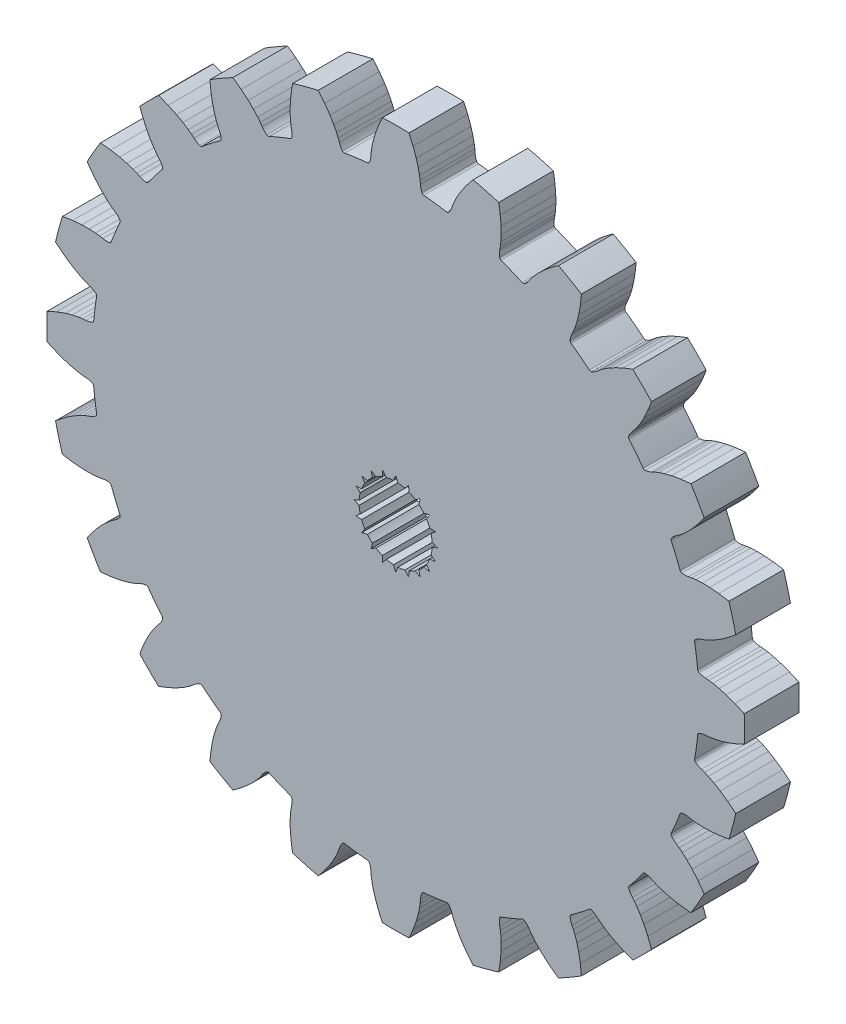
from build123d import *

# Parameters (mm, degrees)
BOSS_EXTRUDE1_DEPTH = 6.35
CUT_EXTRUDE1_DEPTH  = 58.632651032


with BuildPart() as part:
    # Model → Boss-Extrude1 (new body)
    with BuildSketch(Plane.XY):
        with BuildLine():
            ThreePointArc((34.918122358, -4.597058019), (34.999024317, -3.934019352), (35.067337394, -3.269565647))
            ThreePointArc((35.067337394, -3.269565647), (35.117289307, -3.136889034), (35.227836474, -3.048133181))
            ThreePointArc((35.227836474, -3.048133181), (35.597586296, -2.925959175), (35.983262257, -2.872149586))
            ThreePointArc((35.983262257, -2.872149586), (36.173696873, -2.859616768), (36.363582299, -2.840487209))
            ThreePointArc((36.363582299, -2.840487209), (36.599053851, -2.809299698), (36.833565008, -2.771563378))
            ThreePointArc((36.833565008, -2.771563378), (37.195949989, -2.701153106), (37.555494844, -2.617439436))
            ThreePointArc((37.555494844, -2.617439436), (37.966482977, -2.506715419), (38.373723351, -2.382915857))
            ThreePointArc((38.373723351, -2.382915857), (38.883469202, -2.208794801), (39.386594794, -2.016379586))
            ThreePointArc((39.386594794, -2.016379586), (39.934832511, -1.784794144), (40.475208291, -1.535414057))
            ThreePointArc((40.475208291, -1.535414057), (40.504320541, 0), (40.475208291, 1.535414057))
            ThreePointArc((40.475208291, 1.535414057), (39.934832515, 1.784794142), (39.386594803, 2.016379583))
            ThreePointArc((39.386594803, 2.016379583), (38.883469215, 2.208794797), (38.373723367, 2.382915852))
            ThreePointArc((38.373723367, 2.382915852), (37.966482996, 2.506715414), (37.555494865, 2.617439431))
            ThreePointArc((37.555494865, 2.617439431), (37.195950011, 2.701153102), (36.83356503, 2.771563374))
            ThreePointArc((36.83356503, 2.771563374), (36.599053872, 2.809299694), (36.363582319, 2.840487206))
            ThreePointArc((36.363582319, 2.840487206), (36.173696892, 2.859616766), (35.983262273, 2.872149585))
            ThreePointArc((35.983262273, 2.872149585), (35.597586321, 2.925959167), (35.227836504, 3.048133159))
            ThreePointArc((35.227836504, 3.048133159), (35.117289331, 3.136889003), (35.067337397, 3.269565608))
            ThreePointArc((35.067337397, 3.269565608), (34.91812236, 4.597058), (34.718672707, 5.917936879))
            ThreePointArc((34.718672707, 5.917936879), (34.732583315, 6.059021153), (34.816391973, 6.173364435))
            ThreePointArc((34.816391973, 6.173364435), (35.141921916, 6.38707376), (35.500529341, 6.538870115))
            ThreePointArc((35.500529341, 6.538870115), (35.681231323, 6.600263994), (35.859695466, 6.667887693))
            ThreePointArc((35.859695466, 6.667887693), (36.079071597, 6.758957038), (36.295825102, 6.856103477))
            ThreePointArc((36.295825102, 6.856103477), (36.627638596, 7.017906712), (36.953265565, 7.191824964))
            ThreePointArc((36.953265565, 7.191824964), (37.321592132, 7.405147707), (37.682914442, 7.630130466))
            ThreePointArc((37.682914442, 7.630130466), (38.13022528, 7.930250426), (38.56640656, 8.246327736))
            ThreePointArc((38.56640656, 8.246327736), (39.036024807, 8.611916458), (39.493443412, 8.992658669))
            ThreePointArc((39.493443412, 8.992658669), (39.124169287, 10.483289565), (38.698654612, 11.958850852))
            ThreePointArc((38.698654612, 11.958850852), (38.112147379, 12.059873974), (37.522651691, 12.141673971))
            ThreePointArc((37.522651691, 12.141673971), (36.986868971, 12.197314312), (36.449426446, 12.233570402))
            ThreePointArc((36.449426446, 12.233570402), (36.024020769, 12.247750032), (35.598379235, 12.248329665))
            ThreePointArc((35.598379235, 12.248329665), (35.229418882, 12.236133805), (34.861158351, 12.210352771))
            ThreePointArc((34.861158351, 12.210352771), (34.624871089, 12.186107303), (34.389351112, 12.155287604))
            ThreePointArc((34.389351112, 12.155287604), (34.20098478, 12.124619375), (34.013795331, 12.087437043))
            ThreePointArc((34.013795331, 12.087437043), (33.627334023, 12.039592826), (33.23856217, 12.061905546))
            ThreePointArc((33.23856217, 12.061905546), (33.108810098, 12.119025393), (33.026221003, 12.234252641))
            ThreePointArc((33.026221003, 12.234252641), (32.538510031, 13.477892133), (32.00398785, 14.702141787))
            ThreePointArc((32.00398785, 14.702141787), (31.980909169, 14.842019062), (32.032267897, 14.974157468))
            ThreePointArc((32.032267897, 14.974157468), (32.291393633, 15.264838172), (32.598494018, 15.504276623))
            ThreePointArc((32.598494018, 15.504276623), (32.757148825, 15.610347671), (32.912029648, 15.721857067))
            ThreePointArc((32.912029648, 15.721857067), (33.100360238, 15.86660202), (33.284584698, 16.01653821))
            ThreePointArc((33.284584698, 16.01653821), (33.563214162, 16.258707785), (33.832732305, 16.510978377))
            ThreePointArc((33.832732305, 16.510978377), (34.13329646, 16.812362255), (34.424077188, 17.123196008))
            ThreePointArc((34.424077188, 17.123196008), (34.778469517, 17.528862191), (35.117981453, 17.947061451))
            ThreePointArc((35.117981453, 17.947061451), (35.476976522, 18.421739186), (35.820265632, 18.907896567))
            ThreePointArc((35.820265632, 18.907896567), (35.077770552, 20.252160271), (34.284851575, 21.567311724))
            ThreePointArc((34.284851575, 21.567311724), (33.692182383, 21.513093325), (33.101601876, 21.439533344))
            ThreePointArc((33.101601876, 21.439533344), (32.569674729, 21.354607013), (32.041161348, 21.250527346))
            ThreePointArc((32.041161348, 21.250527346), (31.62658106, 21.154120727), (31.215292889, 21.044516473))
            ThreePointArc((31.215292889, 21.044516473), (30.862061076, 20.937242211), (30.513021341, 20.817026805))
            ThreePointArc((30.513021341, 20.817026805), (30.291060561, 20.732451838), (30.071542458, 20.64172524))
            ThreePointArc((30.071542458, 20.64172524), (29.897532074, 20.56334921), (29.726344447, 20.478985641))
            ThreePointArc((29.726344447, 20.478985641), (29.365434484, 20.33274813), (28.984134754, 20.253679002))
            ThreePointArc((28.984134754, 20.253679002), (28.844020171, 20.275270231), (28.734422225, 20.365195575))
            ThreePointArc((28.734422225, 20.365195575), (27.941452016, 21.440230191), (27.10828411, 22.484420029))
            ThreePointArc((27.10828411, 22.484420029), (27.049788913, 22.613557898), (27.065197699, 22.754486415))
            ThreePointArc((27.065197699, 22.754486415), (27.240260237, 23.10232909), (27.4749252, 23.413092302))
            ThreePointArc((27.4749252, 23.413092302), (27.600720768, 23.556611952), (27.721463399, 23.704407864))
            ThreePointArc((27.721463399, 23.704407864), (27.865914029, 23.892964296), (28.005054851, 24.085472333))
            ThreePointArc((28.005054851, 24.085472333), (28.211512149, 24.391504792), (28.40655425, 24.7049359))
            ThreePointArc((28.40655425, 24.7049359), (28.618873042, 25.073842099), (28.819295962, 25.449344039))
            ThreePointArc((28.819295962, 25.449344039), (29.056618531, 25.932910967), (29.276323945, 26.424732587))
            ThreePointArc((29.276323945, 26.424732587), (29.500230916, 26.976150832), (29.705995944, 27.534592561))
            ThreePointArc((29.705995944, 27.534592561), (28.640879722, 28.640879722), (27.534592561, 29.705995944))
            ThreePointArc((27.534592561, 29.705995944), (26.976150836, 29.500230918), (26.424732596, 29.276323949))
            ThreePointArc((26.424732596, 29.276323949), (25.932910979, 29.056618537), (25.449344054, 28.81929597))
            ThreePointArc((25.449344054, 28.81929597), (25.073842116, 28.618873052), (24.704935918, 28.406554261))
            ThreePointArc((24.704935918, 28.406554261), (24.39150481, 28.211512161), (24.085472352, 28.005054864))
            ThreePointArc((24.085472352, 28.005054864), (23.892964314, 27.865914042), (23.704407881, 27.721463412))
            ThreePointArc((23.704407881, 27.721463412), (23.556611966, 27.60072078), (23.413092315, 27.474925211))
            ThreePointArc((23.413092315, 27.474925211), (23.102329113, 27.24026025), (22.754486452, 27.065197706))
            ThreePointArc((22.754486452, 27.065197706), (22.613557937, 27.049788908), (22.484420059, 27.108284085))
            ThreePointArc((22.484420059, 27.108284085), (21.440230222, 27.941451993), (20.365195606, 28.734422203))
            ThreePointArc((20.365195606, 28.734422203), (20.275270245, 28.844020135), (20.253679006, 28.984134716))
            ThreePointArc((20.253679006, 28.984134716), (20.332748124, 29.365434458), (20.478985633, 29.726344432))
            ThreePointArc((20.478985633, 29.726344432), (20.563349202, 29.897532057), (20.641725231, 30.071542439))
            ThreePointArc((20.641725231, 30.071542439), (20.73245183, 30.29106054), (20.817026797, 30.51302132))
            ThreePointArc((20.817026797, 30.51302132), (20.937242204, 30.862061055), (21.044516467, 31.215292869))
            ThreePointArc((21.044516467, 31.215292869), (21.154120722, 31.626581041), (21.250527343, 32.041161331))
            ThreePointArc((21.250527343, 32.041161331), (21.354607011, 32.569674716), (21.439533342, 33.101601867))
            ThreePointArc((21.439533342, 33.101601867), (21.513093325, 33.692182378), (21.567311724, 34.284851575))
            ThreePointArc((21.567311724, 34.284851575), (20.252160271, 35.077770552), (18.907896567, 35.820265632))
            ThreePointArc((18.907896567, 35.820265632), (18.42173919, 35.476976525), (17.947061459, 35.117981459))
            ThreePointArc((17.947061459, 35.117981459), (17.528862202, 34.778469526), (17.123196021, 34.4240772))
            ThreePointArc((17.123196021, 34.4240772), (16.812362269, 34.133296474), (16.510978392, 33.83273232))
            ThreePointArc((16.510978392, 33.83273232), (16.2587078, 33.563214178), (16.016538225, 33.284584715))
            ThreePointArc((16.016538225, 33.284584715), (15.866602034, 33.100360255), (15.72185708, 32.912029664))
            ThreePointArc((15.72185708, 32.912029664), (15.610347682, 32.75714884), (15.504276633, 32.598494032))
            ThreePointArc((15.504276633, 32.598494032), (15.264838191, 32.291393651), (14.974157502, 32.032267913))
            ThreePointArc((14.974157502, 32.032267913), (14.8420191, 31.980909174), (14.702141823, 32.003987833))
            ThreePointArc((14.702141823, 32.003987833), (13.477892169, 32.538510016), (12.234252678, 33.026220989))
            ThreePointArc((12.234252678, 33.026220989), (12.119025417, 33.108810067), (12.061905559, 33.238562135))
            ThreePointArc((12.061905559, 33.238562135), (12.039592826, 33.627333997), (12.087437039, 34.013795315))
            ThreePointArc((12.087437039, 34.013795315), (12.124619372, 34.200984761), (12.155287601, 34.389351092))
            ThreePointArc((12.155287601, 34.389351092), (12.186107301, 34.624871067), (12.210352769, 34.861158328))
            ThreePointArc((12.210352769, 34.861158328), (12.236133804, 35.22941886), (12.248329664, 35.598379214))
            ThreePointArc((12.248329664, 35.598379214), (12.247750033, 36.02402075), (12.233570403, 36.449426428))
            ThreePointArc((12.233570403, 36.449426428), (12.197314313, 36.986868957), (12.141673972, 37.522651682))
            ThreePointArc((12.141673972, 37.522651682), (12.059873975, 38.112147374), (11.958850852, 38.698654612))
            ThreePointArc((11.958850852, 38.698654612), (10.483289565, 39.124169287), (8.992658669, 39.493443412))
            ThreePointArc((8.992658669, 39.493443412), (8.611916461, 39.03602481), (8.246327742, 38.566406568))
            ThreePointArc((8.246327742, 38.566406568), (7.930250433, 38.130225291), (7.630130476, 37.682914457))
            ThreePointArc((7.630130476, 37.682914457), (7.405147717, 37.321592149), (7.191824974, 36.953265583))
            ThreePointArc((7.191824974, 36.953265583), (7.017906722, 36.627638615), (6.856103487, 36.295825123))
            ThreePointArc((6.856103487, 36.295825123), (6.758957046, 36.079071617), (6.6678877, 35.859695485))
            ThreePointArc((6.6678877, 35.859695485), (6.600264, 35.681231341), (6.53887012, 35.500529357))
            ThreePointArc((6.53887012, 35.500529357), (6.387073773, 35.141921939), (6.173364465, 34.816391997))
            ThreePointArc((6.173364465, 34.816391997), (6.059021189, 34.73258333), (5.917936918, 34.7186727))
            ThreePointArc((5.917936918, 34.7186727), (4.597058039, 34.918122355), (3.269565647, 35.067337394))
            ThreePointArc((3.269565647, 35.067337394), (3.136889034, 35.117289307), (3.048133181, 35.227836474))
            ThreePointArc((3.048133181, 35.227836474), (2.925959175, 35.597586296), (2.872149586, 35.983262257))
            ThreePointArc((2.872149586, 35.983262257), (2.859616768, 36.173696873), (2.840487209, 36.363582299))
            ThreePointArc((2.840487209, 36.363582299), (2.809299698, 36.599053851), (2.771563378, 36.833565008))
            ThreePointArc((2.771563378, 36.833565008), (2.701153106, 37.195949989), (2.617439436, 37.555494844))
            ThreePointArc((2.617439436, 37.555494844), (2.506715419, 37.966482977), (2.382915857, 38.373723351))
            ThreePointArc((2.382915857, 38.373723351), (2.208794801, 38.883469202), (2.016379586, 39.386594794))
            ThreePointArc((2.016379586, 39.386594794), (1.784794144, 39.934832511), (1.535414057, 40.475208291))
            ThreePointArc((1.535414057, 40.475208291), (0, 40.504320541), (-1.535414057, 40.475208291))
            ThreePointArc((-1.535414057, 40.475208291), (-1.784794142, 39.934832515), (-2.016379583, 39.386594803))
            ThreePointArc((-2.016379583, 39.386594803), (-2.208794797, 38.883469215), (-2.382915852, 38.373723367))
            ThreePointArc((-2.382915852, 38.373723367), (-2.506715414, 37.966482996), (-2.617439431, 37.555494865))
            ThreePointArc((-2.617439431, 37.555494865), (-2.701153102, 37.195950011), (-2.771563374, 36.83356503))
            ThreePointArc((-2.771563374, 36.83356503), (-2.809299694, 36.599053872), (-2.840487206, 36.363582319))
            ThreePointArc((-2.840487206, 36.363582319), (-2.859616766, 36.173696892), (-2.872149585, 35.983262273))
            ThreePointArc((-2.872149585, 35.983262273), (-2.925959167, 35.597586321), (-3.048133159, 35.227836504))
            ThreePointArc((-3.048133159, 35.227836504), (-3.136889003, 35.117289331), (-3.269565608, 35.067337397))
            ThreePointArc((-3.269565608, 35.067337397), (-4.597058, 34.91812236), (-5.917936879, 34.718672707))
            ThreePointArc((-5.917936879, 34.718672707), (-6.059021153, 34.732583315), (-6.173364435, 34.816391973))
            ThreePointArc((-6.173364435, 34.816391973), (-6.38707376, 35.141921916), (-6.538870115, 35.500529341))
            ThreePointArc((-6.538870115, 35.500529341), (-6.600263994, 35.681231323), (-6.667887693, 35.859695466))
            ThreePointArc((-6.667887693, 35.859695466), (-6.758957038, 36.079071597), (-6.856103477, 36.295825102))
            ThreePointArc((-6.856103477, 36.295825102), (-7.017906712, 36.627638596), (-7.191824964, 36.953265565))
            ThreePointArc((-7.191824964, 36.953265565), (-7.405147707, 37.321592132), (-7.630130466, 37.682914442))
            ThreePointArc((-7.630130466, 37.682914442), (-7.930250426, 38.13022528), (-8.246327736, 38.56640656))
            ThreePointArc((-8.246327736, 38.56640656), (-8.611916458, 39.036024807), (-8.992658669, 39.493443412))
            ThreePointArc((-8.992658669, 39.493443412), (-10.483289565, 39.124169287), (-11.958850852, 38.698654612))
            ThreePointArc((-11.958850852, 38.698654612), (-12.059873974, 38.112147379), (-12.141673971, 37.522651691))
            ThreePointArc((-12.141673971, 37.522651691), (-12.197314312, 36.986868971), (-12.233570402, 36.449426446))
            ThreePointArc((-12.233570402, 36.449426446), (-12.247750032, 36.024020769), (-12.248329665, 35.598379235))
            ThreePointArc((-12.248329665, 35.598379235), (-12.236133805, 35.229418882), (-12.210352771, 34.861158351))
            ThreePointArc((-12.210352771, 34.861158351), (-12.186107303, 34.624871089), (-12.155287604, 34.389351112))
            ThreePointArc((-12.155287604, 34.389351112), (-12.124619375, 34.20098478), (-12.087437043, 34.013795331))
            ThreePointArc((-12.087437043, 34.013795331), (-12.039592826, 33.627334023), (-12.061905546, 33.23856217))
            ThreePointArc((-12.061905546, 33.23856217), (-12.119025393, 33.108810098), (-12.234252641, 33.026221003))
            ThreePointArc((-12.234252641, 33.026221003), (-13.477892133, 32.538510031), (-14.702141787, 32.00398785))
            ThreePointArc((-14.702141787, 32.00398785), (-14.842019062, 31.980909169), (-14.974157468, 32.032267897))
            ThreePointArc((-14.974157468, 32.032267897), (-15.264838172, 32.291393633), (-15.504276623, 32.598494018))
            ThreePointArc((-15.504276623, 32.598494018), (-15.610347671, 32.757148825), (-15.721857067, 32.912029648))
            ThreePointArc((-15.721857067, 32.912029648), (-15.86660202, 33.100360238), (-16.01653821, 33.284584698))
            ThreePointArc((-16.01653821, 33.284584698), (-16.258707785, 33.563214162), (-16.510978377, 33.832732305))
            ThreePointArc((-16.510978377, 33.832732305), (-16.812362255, 34.13329646), (-17.123196008, 34.424077188))
            ThreePointArc((-17.123196008, 34.424077188), (-17.528862191, 34.778469517), (-17.947061451, 35.117981453))
            ThreePointArc((-17.947061451, 35.117981453), (-18.421739186, 35.476976522), (-18.907896567, 35.820265632))
            ThreePointArc((-18.907896567, 35.820265632), (-20.252160271, 35.077770552), (-21.567311724, 34.284851575))
            ThreePointArc((-21.567311724, 34.284851575), (-21.513093325, 33.692182383), (-21.439533344, 33.101601876))
            ThreePointArc((-21.439533344, 33.101601876), (-21.354607013, 32.569674729), (-21.250527346, 32.041161348))
            ThreePointArc((-21.250527346, 32.041161348), (-21.154120727, 31.62658106), (-21.044516473, 31.215292889))
            ThreePointArc((-21.044516473, 31.215292889), (-20.937242211, 30.862061076), (-20.817026805, 30.513021341))
            ThreePointArc((-20.817026805, 30.513021341), (-20.732451838, 30.291060561), (-20.64172524, 30.071542458))
            ThreePointArc((-20.64172524, 30.071542458), (-20.56334921, 29.897532074), (-20.478985641, 29.726344447))
            ThreePointArc((-20.478985641, 29.726344447), (-20.33274813, 29.365434484), (-20.253679002, 28.984134754))
            ThreePointArc((-20.253679002, 28.984134754), (-20.275270231, 28.844020171), (-20.365195575, 28.734422225))
            ThreePointArc((-20.365195575, 28.734422225), (-21.440230191, 27.941452016), (-22.484420029, 27.10828411))
            ThreePointArc((-22.484420029, 27.10828411), (-22.613557898, 27.049788913), (-22.754486415, 27.065197699))
            ThreePointArc((-22.754486415, 27.065197699), (-23.10232909, 27.240260237), (-23.413092302, 27.4749252))
            ThreePointArc((-23.413092302, 27.4749252), (-23.556611952, 27.600720768), (-23.704407864, 27.721463399))
            ThreePointArc((-23.704407864, 27.721463399), (-23.892964296, 27.865914029), (-24.085472333, 28.005054851))
            ThreePointArc((-24.085472333, 28.005054851), (-24.391504792, 28.211512149), (-24.7049359, 28.40655425))
            ThreePointArc((-24.7049359, 28.40655425), (-25.073842099, 28.618873042), (-25.449344039, 28.819295962))
            ThreePointArc((-25.449344039, 28.819295962), (-25.932910967, 29.056618531), (-26.424732587, 29.276323945))
            ThreePointArc((-26.424732587, 29.276323945), (-26.976150832, 29.500230916), (-27.534592561, 29.705995944))
            ThreePointArc((-27.534592561, 29.705995944), (-28.640879722, 28.640879722), (-29.705995944, 27.534592561))
            ThreePointArc((-29.705995944, 27.534592561), (-29.500230918, 26.976150836), (-29.276323949, 26.424732596))
            ThreePointArc((-29.276323949, 26.424732596), (-29.056618537, 25.932910979), (-28.81929597, 25.449344054))
            ThreePointArc((-28.81929597, 25.449344054), (-28.618873052, 25.073842116), (-28.406554261, 24.704935918))
            ThreePointArc((-28.406554261, 24.704935918), (-28.211512161, 24.39150481), (-28.005054864, 24.085472352))
            ThreePointArc((-28.005054864, 24.085472352), (-27.865914042, 23.892964314), (-27.721463412, 23.704407881))
            ThreePointArc((-27.721463412, 23.704407881), (-27.60072078, 23.556611966), (-27.474925211, 23.413092315))
            ThreePointArc((-27.474925211, 23.413092315), (-27.24026025, 23.102329113), (-27.065197706, 22.754486452))
            ThreePointArc((-27.065197706, 22.754486452), (-27.049788908, 22.613557937), (-27.108284085, 22.484420059))
            ThreePointArc((-27.108284085, 22.484420059), (-27.941451993, 21.440230222), (-28.734422203, 20.365195606))
            ThreePointArc((-28.734422203, 20.365195606), (-28.844020135, 20.275270245), (-28.984134716, 20.253679006))
            ThreePointArc((-28.984134716, 20.253679006), (-29.365434458, 20.332748124), (-29.726344432, 20.478985633))
            ThreePointArc((-29.726344432, 20.478985633), (-29.897532057, 20.563349202), (-30.071542439, 20.641725231))
            ThreePointArc((-30.071542439, 20.641725231), (-30.29106054, 20.73245183), (-30.51302132, 20.817026797))
            ThreePointArc((-30.51302132, 20.817026797), (-30.862061055, 20.937242204), (-31.215292869, 21.044516467))
            ThreePointArc((-31.215292869, 21.044516467), (-31.626581041, 21.154120722), (-32.041161331, 21.250527343))
            ThreePointArc((-32.041161331, 21.250527343), (-32.569674716, 21.354607011), (-33.101601867, 21.439533342))
            ThreePointArc((-33.101601867, 21.439533342), (-33.692182378, 21.513093325), (-34.284851575, 21.567311724))
            ThreePointArc((-34.284851575, 21.567311724), (-35.077770552, 20.252160271), (-35.820265632, 18.907896567))
            ThreePointArc((-35.820265632, 18.907896567), (-35.476976525, 18.42173919), (-35.117981459, 17.947061459))
            ThreePointArc((-35.117981459, 17.947061459), (-34.778469526, 17.528862202), (-34.4240772, 17.123196021))
            ThreePointArc((-34.4240772, 17.123196021), (-34.133296474, 16.812362269), (-33.83273232, 16.510978392))
            ThreePointArc((-33.83273232, 16.510978392), (-33.563214178, 16.2587078), (-33.284584715, 16.016538225))
            ThreePointArc((-33.284584715, 16.016538225), (-33.100360255, 15.866602034), (-32.912029664, 15.72185708))
            ThreePointArc((-32.912029664, 15.72185708), (-32.75714884, 15.610347682), (-32.598494032, 15.504276633))
            ThreePointArc((-32.598494032, 15.504276633), (-32.291393651, 15.264838191), (-32.032267913, 14.974157502))
            ThreePointArc((-32.032267913, 14.974157502), (-31.980909174, 14.8420191), (-32.003987833, 14.702141823))
            ThreePointArc((-32.003987833, 14.702141823), (-32.538510016, 13.477892169), (-33.026220989, 12.234252678))
            ThreePointArc((-33.026220989, 12.234252678), (-33.108810067, 12.119025417), (-33.238562135, 12.061905559))
            ThreePointArc((-33.238562135, 12.061905559), (-33.627333997, 12.039592826), (-34.013795315, 12.087437039))
            ThreePointArc((-34.013795315, 12.087437039), (-34.200984761, 12.124619372), (-34.389351092, 12.155287601))
            ThreePointArc((-34.389351092, 12.155287601), (-34.624871067, 12.186107301), (-34.861158328, 12.210352769))
            ThreePointArc((-34.861158328, 12.210352769), (-35.22941886, 12.236133804), (-35.598379214, 12.248329664))
            ThreePointArc((-35.598379214, 12.248329664), (-36.02402075, 12.247750033), (-36.449426428, 12.233570403))
            ThreePointArc((-36.449426428, 12.233570403), (-36.986868957, 12.197314313), (-37.522651682, 12.141673972))
            ThreePointArc((-37.522651682, 12.141673972), (-38.112147374, 12.059873975), (-38.698654612, 11.958850852))
            ThreePointArc((-38.698654612, 11.958850852), (-39.124169287, 10.483289565), (-39.493443412, 8.992658669))
            ThreePointArc((-39.493443412, 8.992658669), (-39.03602481, 8.611916461), (-38.566406568, 8.246327742))
            ThreePointArc((-38.566406568, 8.246327742), (-38.130225291, 7.930250433), (-37.682914457, 7.630130476))
            ThreePointArc((-37.682914457, 7.630130476), (-37.321592149, 7.405147717), (-36.953265583, 7.191824974))
            ThreePointArc((-36.953265583, 7.191824974), (-36.627638615, 7.017906722), (-36.295825123, 6.856103487))
            ThreePointArc((-36.295825123, 6.856103487), (-36.079071617, 6.758957046), (-35.859695485, 6.6678877))
            ThreePointArc((-35.859695485, 6.6678877), (-35.681231341, 6.600264), (-35.500529357, 6.53887012))
            ThreePointArc((-35.500529357, 6.53887012), (-35.141921939, 6.387073773), (-34.816391997, 6.173364465))
            ThreePointArc((-34.816391997, 6.173364465), (-34.73258333, 6.059021189), (-34.7186727, 5.917936918))
            ThreePointArc((-34.7186727, 5.917936918), (-34.918122355, 4.597058039), (-35.067337394, 3.269565647))
            ThreePointArc((-35.067337394, 3.269565647), (-35.117289307, 3.136889034), (-35.227836474, 3.048133181))
            ThreePointArc((-35.227836474, 3.048133181), (-35.597586296, 2.925959175), (-35.983262257, 2.872149586))
            ThreePointArc((-35.983262257, 2.872149586), (-36.173696873, 2.859616768), (-36.363582299, 2.840487209))
            ThreePointArc((-36.363582299, 2.840487209), (-36.599053851, 2.809299698), (-36.833565008, 2.771563378))
            ThreePointArc((-36.833565008, 2.771563378), (-37.195949989, 2.701153106), (-37.555494844, 2.617439436))
            ThreePointArc((-37.555494844, 2.617439436), (-37.966482977, 2.506715419), (-38.373723351, 2.382915857))
            ThreePointArc((-38.373723351, 2.382915857), (-38.883469202, 2.208794801), (-39.386594794, 2.016379586))
            ThreePointArc((-39.386594794, 2.016379586), (-39.934832511, 1.784794144), (-40.475208291, 1.535414057))
            ThreePointArc((-40.475208291, 1.535414057), (-40.504320541, 0), (-40.475208291, -1.535414057))
            ThreePointArc((-40.475208291, -1.535414057), (-39.934832515, -1.784794142), (-39.386594803, -2.016379583))
            ThreePointArc((-39.386594803, -2.016379583), (-38.883469215, -2.208794797), (-38.373723367, -2.382915852))
            ThreePointArc((-38.373723367, -2.382915852), (-37.966482996, -2.506715414), (-37.555494865, -2.617439431))
            ThreePointArc((-37.555494865, -2.617439431), (-37.195950011, -2.701153102), (-36.83356503, -2.771563374))
            ThreePointArc((-36.83356503, -2.771563374), (-36.599053872, -2.809299694), (-36.363582319, -2.840487206))
            ThreePointArc((-36.363582319, -2.840487206), (-36.173696892, -2.859616766), (-35.983262273, -2.872149585))
            ThreePointArc((-35.983262273, -2.872149585), (-35.597586321, -2.925959167), (-35.227836504, -3.048133159))
            ThreePointArc((-35.227836504, -3.048133159), (-35.117289331, -3.136889003), (-35.067337397, -3.269565608))
            ThreePointArc((-35.067337397, -3.269565608), (-34.91812236, -4.597058), (-34.718672707, -5.917936879))
            ThreePointArc((-34.718672707, -5.917936879), (-34.732583315, -6.059021153), (-34.816391973, -6.173364435))
            ThreePointArc((-34.816391973, -6.173364435), (-35.141921916, -6.38707376), (-35.500529341, -6.538870115))
            ThreePointArc((-35.500529341, -6.538870115), (-35.681231323, -6.600263994), (-35.859695466, -6.667887693))
            ThreePointArc((-35.859695466, -6.667887693), (-36.079071597, -6.758957038), (-36.295825102, -6.856103477))
            ThreePointArc((-36.295825102, -6.856103477), (-36.627638596, -7.017906712), (-36.953265565, -7.191824964))
            ThreePointArc((-36.953265565, -7.191824964), (-37.321592132, -7.405147707), (-37.682914442, -7.630130466))
            ThreePointArc((-37.682914442, -7.630130466), (-38.13022528, -7.930250426), (-38.56640656, -8.246327736))
            ThreePointArc((-38.56640656, -8.246327736), (-39.036024807, -8.611916458), (-39.493443412, -8.992658669))
            ThreePointArc((-39.493443412, -8.992658669), (-39.124169287, -10.483289565), (-38.698654612, -11.958850852))
            ThreePointArc((-38.698654612, -11.958850852), (-38.112147379, -12.059873974), (-37.522651691, -12.141673971))
            ThreePointArc((-37.522651691, -12.141673971), (-36.986868971, -12.197314312), (-36.449426446, -12.233570402))
            ThreePointArc((-36.449426446, -12.233570402), (-36.024020769, -12.247750032), (-35.598379235, -12.248329665))
            ThreePointArc((-35.598379235, -12.248329665), (-35.229418882, -12.236133805), (-34.861158351, -12.210352771))
            ThreePointArc((-34.861158351, -12.210352771), (-34.624871089, -12.186107303), (-34.389351112, -12.155287604))
            ThreePointArc((-34.389351112, -12.155287604), (-34.20098478, -12.124619375), (-34.013795331, -12.087437043))
            ThreePointArc((-34.013795331, -12.087437043), (-33.627334023, -12.039592826), (-33.23856217, -12.061905546))
            ThreePointArc((-33.23856217, -12.061905546), (-33.108810098, -12.119025393), (-33.026221003, -12.234252641))
            ThreePointArc((-33.026221003, -12.234252641), (-32.538510031, -13.477892133), (-32.00398785, -14.702141787))
            ThreePointArc((-32.00398785, -14.702141787), (-31.980909169, -14.842019062), (-32.032267897, -14.974157468))
            ThreePointArc((-32.032267897, -14.974157468), (-32.291393633, -15.264838172), (-32.598494018, -15.504276623))
            ThreePointArc((-32.598494018, -15.504276623), (-32.757148825, -15.610347671), (-32.912029648, -15.721857067))
            ThreePointArc((-32.912029648, -15.721857067), (-33.100360238, -15.86660202), (-33.284584698, -16.01653821))
            ThreePointArc((-33.284584698, -16.01653821), (-33.563214162, -16.258707785), (-33.832732305, -16.510978377))
            ThreePointArc((-33.832732305, -16.510978377), (-34.13329646, -16.812362255), (-34.424077188, -17.123196008))
            ThreePointArc((-34.424077188, -17.123196008), (-34.778469517, -17.528862191), (-35.117981453, -17.947061451))
            ThreePointArc((-35.117981453, -17.947061451), (-35.476976522, -18.421739186), (-35.820265632, -18.907896567))
            ThreePointArc((-35.820265632, -18.907896567), (-35.077770552, -20.252160271), (-34.284851575, -21.567311724))
            ThreePointArc((-34.284851575, -21.567311724), (-33.692182383, -21.513093325), (-33.101601876, -21.439533344))
            ThreePointArc((-33.101601876, -21.439533344), (-32.569674729, -21.354607013), (-32.041161348, -21.250527346))
            ThreePointArc((-32.041161348, -21.250527346), (-31.62658106, -21.154120727), (-31.215292889, -21.044516473))
            ThreePointArc((-31.215292889, -21.044516473), (-30.862061076, -20.937242211), (-30.513021341, -20.817026805))
            ThreePointArc((-30.513021341, -20.817026805), (-30.291060561, -20.732451838), (-30.071542458, -20.64172524))
            ThreePointArc((-30.071542458, -20.64172524), (-29.897532074, -20.56334921), (-29.726344447, -20.478985641))
            ThreePointArc((-29.726344447, -20.478985641), (-29.365434484, -20.33274813), (-28.984134754, -20.253679002))
            ThreePointArc((-28.984134754, -20.253679002), (-28.844020171, -20.275270231), (-28.734422225, -20.365195575))
            ThreePointArc((-28.734422225, -20.365195575), (-27.941452016, -21.440230191), (-27.10828411, -22.484420029))
            ThreePointArc((-27.10828411, -22.484420029), (-27.049788913, -22.613557898), (-27.065197699, -22.754486415))
            ThreePointArc((-27.065197699, -22.754486415), (-27.240260237, -23.10232909), (-27.4749252, -23.413092302))
            ThreePointArc((-27.4749252, -23.413092302), (-27.600720768, -23.556611952), (-27.721463399, -23.704407864))
            ThreePointArc((-27.721463399, -23.704407864), (-27.865914029, -23.892964296), (-28.005054851, -24.085472333))
            ThreePointArc((-28.005054851, -24.085472333), (-28.211512149, -24.391504792), (-28.40655425, -24.7049359))
            ThreePointArc((-28.40655425, -24.7049359), (-28.618873042, -25.073842099), (-28.819295962, -25.449344039))
            ThreePointArc((-28.819295962, -25.449344039), (-29.056618531, -25.932910967), (-29.276323945, -26.424732587))
            ThreePointArc((-29.276323945, -26.424732587), (-29.500230916, -26.976150832), (-29.705995944, -27.534592561))
            ThreePointArc((-29.705995944, -27.534592561), (-28.640879722, -28.640879722), (-27.534592561, -29.705995944))
            ThreePointArc((-27.534592561, -29.705995944), (-26.976150836, -29.500230918), (-26.424732596, -29.276323949))
            ThreePointArc((-26.424732596, -29.276323949), (-25.932910979, -29.056618537), (-25.449344054, -28.81929597))
            ThreePointArc((-25.449344054, -28.81929597), (-25.073842116, -28.618873052), (-24.704935918, -28.406554261))
            ThreePointArc((-24.704935918, -28.406554261), (-24.39150481, -28.211512161), (-24.085472352, -28.005054864))
            ThreePointArc((-24.085472352, -28.005054864), (-23.892964314, -27.865914042), (-23.704407881, -27.721463412))
            ThreePointArc((-23.704407881, -27.721463412), (-23.556611966, -27.60072078), (-23.413092315, -27.474925211))
            ThreePointArc((-23.413092315, -27.474925211), (-23.102329113, -27.24026025), (-22.754486452, -27.065197706))
            ThreePointArc((-22.754486452, -27.065197706), (-22.613557937, -27.049788908), (-22.484420059, -27.108284085))
            ThreePointArc((-22.484420059, -27.108284085), (-21.440230222, -27.941451993), (-20.365195606, -28.734422203))
            ThreePointArc((-20.365195606, -28.734422203), (-20.275270245, -28.844020135), (-20.253679006, -28.984134716))
            ThreePointArc((-20.253679006, -28.984134716), (-20.332748124, -29.365434458), (-20.478985633, -29.726344432))
            ThreePointArc((-20.478985633, -29.726344432), (-20.563349202, -29.897532057), (-20.641725231, -30.071542439))
            ThreePointArc((-20.641725231, -30.071542439), (-20.73245183, -30.29106054), (-20.817026797, -30.51302132))
            ThreePointArc((-20.817026797, -30.51302132), (-20.937242204, -30.862061055), (-21.044516467, -31.215292869))
            ThreePointArc((-21.044516467, -31.215292869), (-21.154120722, -31.626581041), (-21.250527343, -32.041161331))
            ThreePointArc((-21.250527343, -32.041161331), (-21.354607011, -32.569674716), (-21.439533342, -33.101601867))
            ThreePointArc((-21.439533342, -33.101601867), (-21.513093325, -33.692182378), (-21.567311724, -34.284851575))
            ThreePointArc((-21.567311724, -34.284851575), (-20.252160271, -35.077770552), (-18.907896567, -35.820265632))
            ThreePointArc((-18.907896567, -35.820265632), (-18.42173919, -35.476976525), (-17.947061459, -35.117981459))
            ThreePointArc((-17.947061459, -35.117981459), (-17.528862202, -34.778469526), (-17.123196021, -34.4240772))
            ThreePointArc((-17.123196021, -34.4240772), (-16.812362269, -34.133296474), (-16.510978392, -33.83273232))
            ThreePointArc((-16.510978392, -33.83273232), (-16.2587078, -33.563214178), (-16.016538225, -33.284584715))
            ThreePointArc((-16.016538225, -33.284584715), (-15.866602034, -33.100360255), (-15.72185708, -32.912029664))
            ThreePointArc((-15.72185708, -32.912029664), (-15.610347682, -32.75714884), (-15.504276633, -32.598494032))
            ThreePointArc((-15.504276633, -32.598494032), (-15.264838191, -32.291393651), (-14.974157502, -32.032267913))
            ThreePointArc((-14.974157502, -32.032267913), (-14.8420191, -31.980909174), (-14.702141823, -32.003987833))
            ThreePointArc((-14.702141823, -32.003987833), (-13.477892169, -32.538510016), (-12.234252678, -33.026220989))
            ThreePointArc((-12.234252678, -33.026220989), (-12.119025417, -33.108810067), (-12.061905559, -33.238562135))
            ThreePointArc((-12.061905559, -33.238562135), (-12.039592826, -33.627333997), (-12.087437039, -34.013795315))
            ThreePointArc((-12.087437039, -34.013795315), (-12.124619372, -34.200984761), (-12.155287601, -34.389351092))
            ThreePointArc((-12.155287601, -34.389351092), (-12.186107301, -34.624871067), (-12.210352769, -34.861158328))
            ThreePointArc((-12.210352769, -34.861158328), (-12.236133804, -35.22941886), (-12.248329664, -35.598379214))
            ThreePointArc((-12.248329664, -35.598379214), (-12.247750033, -36.02402075), (-12.233570403, -36.449426428))
            ThreePointArc((-12.233570403, -36.449426428), (-12.197314313, -36.986868957), (-12.141673972, -37.522651682))
            ThreePointArc((-12.141673972, -37.522651682), (-12.059873975, -38.112147374), (-11.958850852, -38.698654612))
            ThreePointArc((-11.958850852, -38.698654612), (-10.483289565, -39.124169287), (-8.992658669, -39.493443412))
            ThreePointArc((-8.992658669, -39.493443412), (-8.611916461, -39.03602481), (-8.246327742, -38.566406568))
            ThreePointArc((-8.246327742, -38.566406568), (-7.930250433, -38.130225291), (-7.630130476, -37.682914457))
            ThreePointArc((-7.630130476, -37.682914457), (-7.405147717, -37.321592149), (-7.191824974, -36.953265583))
            ThreePointArc((-7.191824974, -36.953265583), (-7.017906722, -36.627638615), (-6.856103487, -36.295825123))
            ThreePointArc((-6.856103487, -36.295825123), (-6.758957046, -36.079071617), (-6.6678877, -35.859695485))
            ThreePointArc((-6.6678877, -35.859695485), (-6.600264, -35.681231341), (-6.53887012, -35.500529357))
            ThreePointArc((-6.53887012, -35.500529357), (-6.387073773, -35.141921939), (-6.173364465, -34.816391997))
            ThreePointArc((-6.173364465, -34.816391997), (-6.059021189, -34.73258333), (-5.917936918, -34.7186727))
            ThreePointArc((-5.917936918, -34.7186727), (-4.597058039, -34.918122355), (-3.269565647, -35.067337394))
            ThreePointArc((-3.269565647, -35.067337394), (-3.136889034, -35.117289307), (-3.048133181, -35.227836474))
            ThreePointArc((-3.048133181, -35.227836474), (-2.925959175, -35.597586296), (-2.872149586, -35.983262257))
            ThreePointArc((-2.872149586, -35.983262257), (-2.859616768, -36.173696873), (-2.840487209, -36.363582299))
            ThreePointArc((-2.840487209, -36.363582299), (-2.809299698, -36.599053851), (-2.771563378, -36.833565008))
            ThreePointArc((-2.771563378, -36.833565008), (-2.701153106, -37.195949989), (-2.617439436, -37.555494844))
            ThreePointArc((-2.617439436, -37.555494844), (-2.506715419, -37.966482977), (-2.382915857, -38.373723351))
            ThreePointArc((-2.382915857, -38.373723351), (-2.208794801, -38.883469202), (-2.016379586, -39.386594794))
            ThreePointArc((-2.016379586, -39.386594794), (-1.784794144, -39.934832511), (-1.535414057, -40.475208291))
            ThreePointArc((-1.535414057, -40.475208291), (0, -40.504320541), (1.535414057, -40.475208291))
            ThreePointArc((1.535414057, -40.475208291), (1.784794142, -39.934832515), (2.016379583, -39.386594803))
            ThreePointArc((2.016379583, -39.386594803), (2.208794797, -38.883469215), (2.382915852, -38.373723367))
            ThreePointArc((2.382915852, -38.373723367), (2.506715414, -37.966482996), (2.617439431, -37.555494865))
            ThreePointArc((2.617439431, -37.555494865), (2.701153102, -37.195950011), (2.771563374, -36.83356503))
            ThreePointArc((2.771563374, -36.83356503), (2.809299694, -36.599053872), (2.840487206, -36.363582319))
            ThreePointArc((2.840487206, -36.363582319), (2.859616766, -36.173696892), (2.872149585, -35.983262273))
            ThreePointArc((2.872149585, -35.983262273), (2.925959167, -35.597586321), (3.048133159, -35.227836504))
            ThreePointArc((3.048133159, -35.227836504), (3.136889003, -35.117289331), (3.269565608, -35.067337397))
            ThreePointArc((3.269565608, -35.067337397), (4.597058, -34.91812236), (5.917936879, -34.718672707))
            ThreePointArc((5.917936879, -34.718672707), (6.059021153, -34.732583315), (6.173364435, -34.816391973))
            ThreePointArc((6.173364435, -34.816391973), (6.38707376, -35.141921916), (6.538870115, -35.500529341))
            ThreePointArc((6.538870115, -35.500529341), (6.600263994, -35.681231323), (6.667887693, -35.859695466))
            ThreePointArc((6.667887693, -35.859695466), (6.758957038, -36.079071597), (6.856103477, -36.295825102))
            ThreePointArc((6.856103477, -36.295825102), (7.017906712, -36.627638596), (7.191824964, -36.953265565))
            ThreePointArc((7.191824964, -36.953265565), (7.405147707, -37.321592132), (7.630130466, -37.682914442))
            ThreePointArc((7.630130466, -37.682914442), (7.930250426, -38.13022528), (8.246327736, -38.56640656))
            ThreePointArc((8.246327736, -38.56640656), (8.611916458, -39.036024807), (8.992658669, -39.493443412))
            ThreePointArc((8.992658669, -39.493443412), (10.483289565, -39.124169287), (11.958850852, -38.698654612))
            ThreePointArc((11.958850852, -38.698654612), (12.059873974, -38.112147379), (12.141673971, -37.522651691))
            ThreePointArc((12.141673971, -37.522651691), (12.197314312, -36.986868971), (12.233570402, -36.449426446))
            ThreePointArc((12.233570402, -36.449426446), (12.247750032, -36.024020769), (12.248329665, -35.598379235))
            ThreePointArc((12.248329665, -35.598379235), (12.236133805, -35.229418882), (12.210352771, -34.861158351))
            ThreePointArc((12.210352771, -34.861158351), (12.186107303, -34.624871089), (12.155287604, -34.389351112))
            ThreePointArc((12.155287604, -34.389351112), (12.124619375, -34.20098478), (12.087437043, -34.013795331))
            ThreePointArc((12.087437043, -34.013795331), (12.039592826, -33.627334023), (12.061905546, -33.23856217))
            ThreePointArc((12.061905546, -33.23856217), (12.119025393, -33.108810098), (12.234252641, -33.026221003))
            ThreePointArc((12.234252641, -33.026221003), (13.477892133, -32.538510031), (14.702141787, -32.00398785))
            ThreePointArc((14.702141787, -32.00398785), (14.842019062, -31.980909169), (14.974157468, -32.032267897))
            ThreePointArc((14.974157468, -32.032267897), (15.264838172, -32.291393633), (15.504276623, -32.598494018))
            ThreePointArc((15.504276623, -32.598494018), (15.610347671, -32.757148825), (15.721857067, -32.912029648))
            ThreePointArc((15.721857067, -32.912029648), (15.86660202, -33.100360238), (16.01653821, -33.284584698))
            ThreePointArc((16.01653821, -33.284584698), (16.258707785, -33.563214162), (16.510978377, -33.832732305))
            ThreePointArc((16.510978377, -33.832732305), (16.812362255, -34.13329646), (17.123196008, -34.424077188))
            ThreePointArc((17.123196008, -34.424077188), (17.528862191, -34.778469517), (17.947061451, -35.117981453))
            ThreePointArc((17.947061451, -35.117981453), (18.421739186, -35.476976522), (18.907896567, -35.820265632))
            ThreePointArc((18.907896567, -35.820265632), (20.252160271, -35.077770552), (21.567311724, -34.284851575))
            ThreePointArc((21.567311724, -34.284851575), (21.513093325, -33.692182383), (21.439533344, -33.101601876))
            ThreePointArc((21.439533344, -33.101601876), (21.354607013, -32.569674729), (21.250527346, -32.041161348))
            ThreePointArc((21.250527346, -32.041161348), (21.154120727, -31.62658106), (21.044516473, -31.215292889))
            ThreePointArc((21.044516473, -31.215292889), (20.937242211, -30.862061076), (20.817026805, -30.513021341))
            ThreePointArc((20.817026805, -30.513021341), (20.732451838, -30.291060561), (20.64172524, -30.071542458))
            ThreePointArc((20.64172524, -30.071542458), (20.56334921, -29.897532074), (20.478985641, -29.726344447))
            ThreePointArc((20.478985641, -29.726344447), (20.33274813, -29.365434484), (20.253679002, -28.984134754))
            ThreePointArc((20.253679002, -28.984134754), (20.275270231, -28.844020171), (20.365195575, -28.734422225))
            ThreePointArc((20.365195575, -28.734422225), (21.440230191, -27.941452016), (22.484420029, -27.10828411))
            ThreePointArc((22.484420029, -27.10828411), (22.613557898, -27.049788913), (22.754486415, -27.065197699))
            ThreePointArc((22.754486415, -27.065197699), (23.10232909, -27.240260237), (23.413092302, -27.4749252))
            ThreePointArc((23.413092302, -27.4749252), (23.556611952, -27.600720768), (23.704407864, -27.721463399))
            ThreePointArc((23.704407864, -27.721463399), (23.892964296, -27.865914029), (24.085472333, -28.005054851))
            ThreePointArc((24.085472333, -28.005054851), (24.391504792, -28.211512149), (24.7049359, -28.40655425))
            ThreePointArc((24.7049359, -28.40655425), (25.073842099, -28.618873042), (25.449344039, -28.819295962))
            ThreePointArc((25.449344039, -28.819295962), (25.932910967, -29.056618531), (26.424732587, -29.276323945))
            ThreePointArc((26.424732587, -29.276323945), (26.976150832, -29.500230916), (27.534592561, -29.705995944))
            ThreePointArc((27.534592561, -29.705995944), (28.640879722, -28.640879722), (29.705995944, -27.534592561))
            ThreePointArc((29.705995944, -27.534592561), (29.500230918, -26.976150836), (29.276323949, -26.424732596))
            ThreePointArc((29.276323949, -26.424732596), (29.056618537, -25.932910979), (28.81929597, -25.449344054))
            ThreePointArc((28.81929597, -25.449344054), (28.618873052, -25.073842116), (28.406554261, -24.704935918))
            ThreePointArc((28.406554261, -24.704935918), (28.211512161, -24.39150481), (28.005054864, -24.085472352))
            ThreePointArc((28.005054864, -24.085472352), (27.865914042, -23.892964314), (27.721463412, -23.704407881))
            ThreePointArc((27.721463412, -23.704407881), (27.60072078, -23.556611966), (27.474925211, -23.413092315))
            ThreePointArc((27.474925211, -23.413092315), (27.24026025, -23.102329113), (27.065197706, -22.754486452))
            ThreePointArc((27.065197706, -22.754486452), (27.049788908, -22.613557937), (27.108284085, -22.484420059))
            ThreePointArc((27.108284085, -22.484420059), (27.941451993, -21.440230222), (28.734422203, -20.365195606))
            ThreePointArc((28.734422203, -20.365195606), (28.844020135, -20.275270245), (28.984134716, -20.253679006))
            ThreePointArc((28.984134716, -20.253679006), (29.365434458, -20.332748124), (29.726344432, -20.478985633))
            ThreePointArc((29.726344432, -20.478985633), (29.897532057, -20.563349202), (30.071542439, -20.641725231))
            ThreePointArc((30.071542439, -20.641725231), (30.29106054, -20.73245183), (30.51302132, -20.817026797))
            ThreePointArc((30.51302132, -20.817026797), (30.862061055, -20.937242204), (31.215292869, -21.044516467))
            ThreePointArc((31.215292869, -21.044516467), (31.626581041, -21.154120722), (32.041161331, -21.250527343))
            ThreePointArc((32.041161331, -21.250527343), (32.569674716, -21.354607011), (33.101601867, -21.439533342))
            ThreePointArc((33.101601867, -21.439533342), (33.692182378, -21.513093325), (34.284851575, -21.567311724))
            ThreePointArc((34.284851575, -21.567311724), (35.077770552, -20.252160271), (35.820265632, -18.907896567))
            ThreePointArc((35.820265632, -18.907896567), (35.476976525, -18.42173919), (35.117981459, -17.947061459))
            ThreePointArc((35.117981459, -17.947061459), (34.778469526, -17.528862202), (34.4240772, -17.123196021))
            ThreePointArc((34.4240772, -17.123196021), (34.133296474, -16.812362269), (33.83273232, -16.510978392))
            ThreePointArc((33.83273232, -16.510978392), (33.563214178, -16.2587078), (33.284584715, -16.016538225))
            ThreePointArc((33.284584715, -16.016538225), (33.100360255, -15.866602034), (32.912029664, -15.72185708))
            ThreePointArc((32.912029664, -15.72185708), (32.75714884, -15.610347682), (32.598494032, -15.504276633))
            ThreePointArc((32.598494032, -15.504276633), (32.291393651, -15.264838191), (32.032267913, -14.974157502))
            ThreePointArc((32.032267913, -14.974157502), (31.980909174, -14.8420191), (32.003987833, -14.702141823))
            ThreePointArc((32.003987833, -14.702141823), (32.538510016, -13.477892169), (33.026220989, -12.234252678))
            ThreePointArc((33.026220989, -12.234252678), (33.108810067, -12.119025417), (33.238562135, -12.061905559))
            ThreePointArc((33.238562135, -12.061905559), (33.627333997, -12.039592826), (34.013795315, -12.087437039))
            ThreePointArc((34.013795315, -12.087437039), (34.200984761, -12.124619372), (34.389351092, -12.155287601))
            ThreePointArc((34.389351092, -12.155287601), (34.624871067, -12.186107301), (34.861158328, -12.210352769))
            ThreePointArc((34.861158328, -12.210352769), (35.22941886, -12.236133804), (35.598379214, -12.248329664))
            ThreePointArc((35.598379214, -12.248329664), (36.02402075, -12.247750033), (36.449426428, -12.233570403))
            ThreePointArc((36.449426428, -12.233570403), (36.986868957, -12.197314313), (37.522651682, -12.141673972))
            ThreePointArc((37.522651682, -12.141673972), (38.112147374, -12.059873975), (38.698654612, -11.958850852))
            ThreePointArc((38.698654612, -11.958850852), (39.124169287, -10.483289565), (39.493443412, -8.992658669))
            ThreePointArc((39.493443412, -8.992658669), (39.03602481, -8.611916461), (38.566406568, -8.246327742))
            ThreePointArc((38.566406568, -8.246327742), (38.130225291, -7.930250433), (37.682914457, -7.630130476))
            ThreePointArc((37.682914457, -7.630130476), (37.321592149, -7.405147717), (36.953265583, -7.191824974))
            ThreePointArc((36.953265583, -7.191824974), (36.627638615, -7.017906722), (36.295825123, -6.856103487))
            ThreePointArc((36.295825123, -6.856103487), (36.079071617, -6.758957046), (35.859695485, -6.6678877))
            ThreePointArc((35.859695485, -6.6678877), (35.681231341, -6.600264), (35.500529357, -6.53887012))
            ThreePointArc((35.500529357, -6.53887012), (35.141921939, -6.387073773), (34.816391997, -6.173364465))
            ThreePointArc((34.816391997, -6.173364465), (34.73258333, -6.059021189), (34.7186727, -5.917936918))
            ThreePointArc((34.7186727, -5.917936918), (34.824660612, -5.25844318), (34.918122358, -4.597058019))
        make_face()
    extrude(amount=BOSS_EXTRUDE1_DEPTH)

    # Sketch2 → Cut-Extrude1 (cut, through all)
    with BuildSketch(Plane.XY.offset(6.35)):
        with BuildLine():
            Line((0, 5.259210982), (0.250754017, 4.641807171))
            ThreePointArc((0.250754017, 4.641807171), (0.664846476, 4.59688643), (1.072553081, 4.511646987))
            Line((1.072553081, 4.511646987), (1.501822593, 5.021345652))
            Line((1.501822593, 5.021345652), (1.549515564, 4.356672481))
            ThreePointArc((1.549515564, 4.356672481), (1.929459624, 4.18598871), (2.29087121, 3.978932913))
            Line((2.29087121, 3.978932913), (2.856636326, 4.331033575))
            Line((2.856636326, 4.331033575), (2.696599732, 3.684153887))
            ThreePointArc((2.696599732, 3.684153887), (3.00520382, 3.404414803), (3.284942904, 3.095810715))
            Line((3.284942904, 3.095810715), (3.931822593, 3.255847309))
            Line((3.931822593, 3.255847309), (3.57972193, 2.690082193))
            ThreePointArc((3.57972193, 2.690082193), (3.786777728, 2.328670606), (3.957461499, 1.948726547))
            Line((3.957461499, 1.948726547), (4.622134669, 1.901033575))
            Line((4.622134669, 1.901033575), (4.112436004, 1.471764063))
            ThreePointArc((4.112436004, 1.471764063), (4.197675448, 1.064057459), (4.242596189, 0.649964999))
            Line((4.242596189, 0.649964999), (4.86, 0.399210982))
            Line((4.86, 0.399210982), (4.242596189, 0.148456966))
            ThreePointArc((4.242596189, 0.148456966), (4.197675448, -0.265635494), (4.112436004, -0.673342098))
            Line((4.112436004, -0.673342098), (4.622134669, -1.10261161))
            Line((4.622134669, -1.10261161), (3.957461499, -1.150304582))
            ThreePointArc((3.957461499, -1.150304582), (3.786777728, -1.530248641), (3.57972193, -1.891660228))
            Line((3.57972193, -1.891660228), (3.931822593, -2.457425344))
            Line((3.931822593, -2.457425344), (3.284942904, -2.29738875))
            ThreePointArc((3.284942904, -2.29738875), (3.00520382, -2.605992838), (2.696599732, -2.885731922))
            Line((2.696599732, -2.885731922), (2.856636326, -3.53261161))
            Line((2.856636326, -3.53261161), (2.29087121, -3.180510948))
            ThreePointArc((2.29087121, -3.180510948), (1.929459624, -3.387566745), (1.549515564, -3.558250516))
            Line((1.549515564, -3.558250516), (1.501822593, -4.222923687))
            Line((1.501822593, -4.222923687), (1.072553081, -3.713225022))
            ThreePointArc((1.072553081, -3.713225022), (0.664846476, -3.798464465), (0.250754017, -3.843385207))
            Line((0.250754017, -3.843385207), (0, -4.460789018))
            Line((0, -4.460789018), (-0.250754017, -3.843385207))
            ThreePointArc((-0.250754017, -3.843385207), (-0.664846476, -3.798464465), (-1.072553081, -3.713225022))
            Line((-1.072553081, -3.713225022), (-1.501822593, -4.222923687))
            Line((-1.501822593, -4.222923687), (-1.549515564, -3.558250516))
            ThreePointArc((-1.549515564, -3.558250516), (-1.929459624, -3.387566745), (-2.29087121, -3.180510948))
            Line((-2.29087121, -3.180510948), (-2.856636326, -3.53261161))
            Line((-2.856636326, -3.53261161), (-2.696599732, -2.885731922))
            ThreePointArc((-2.696599732, -2.885731922), (-3.00520382, -2.605992838), (-3.284942904, -2.29738875))
            Line((-3.284942904, -2.29738875), (-3.931822593, -2.457425344))
            Line((-3.931822593, -2.457425344), (-3.57972193, -1.891660228))
            ThreePointArc((-3.57972193, -1.891660228), (-3.786777728, -1.530248641), (-3.957461499, -1.150304582))
            Line((-3.957461499, -1.150304582), (-4.622134669, -1.10261161))
            Line((-4.622134669, -1.10261161), (-4.112436004, -0.673342098))
            ThreePointArc((-4.112436004, -0.673342098), (-4.197675448, -0.265635494), (-4.242596189, 0.148456966))
            Line((-4.242596189, 0.148456966), (-4.86, 0.399210982))
            Line((-4.86, 0.399210982), (-4.242596189, 0.649964999))
            ThreePointArc((-4.242596189, 0.649964999), (-4.197675448, 1.064057459), (-4.112436004, 1.471764063))
            Line((-4.112436004, 1.471764063), (-4.622134669, 1.901033575))
            Line((-4.622134669, 1.901033575), (-3.957461499, 1.948726547))
            ThreePointArc((-3.957461499, 1.948726547), (-3.786777728, 2.328670606), (-3.57972193, 2.690082193))
            Line((-3.57972193, 2.690082193), (-3.931822593, 3.255847309))
            Line((-3.931822593, 3.255847309), (-3.284942904, 3.095810715))
            ThreePointArc((-3.284942904, 3.095810715), (-3.00520382, 3.404414803), (-2.696599732, 3.684153887))
            Line((-2.696599732, 3.684153887), (-2.856636326, 4.331033575))
            Line((-2.856636326, 4.331033575), (-2.29087121, 3.978932913))
            ThreePointArc((-2.29087121, 3.978932913), (-1.929459624, 4.18598871), (-1.549515564, 4.356672481))
            Line((-1.549515564, 4.356672481), (-1.501822593, 5.021345652))
            Line((-1.501822593, 5.021345652), (-1.072553081, 4.511646987))
            ThreePointArc((-1.072553081, 4.511646987), (-0.664846476, 4.59688643), (-0.250754017, 4.641807171))
            Line((-0.250754017, 4.641807171), (0, 5.259210982))
        make_face()
    extrude(amount=-CUT_EXTRUDE1_DEPTH, mode=Mode.SUBTRACT)


solid = part.part
